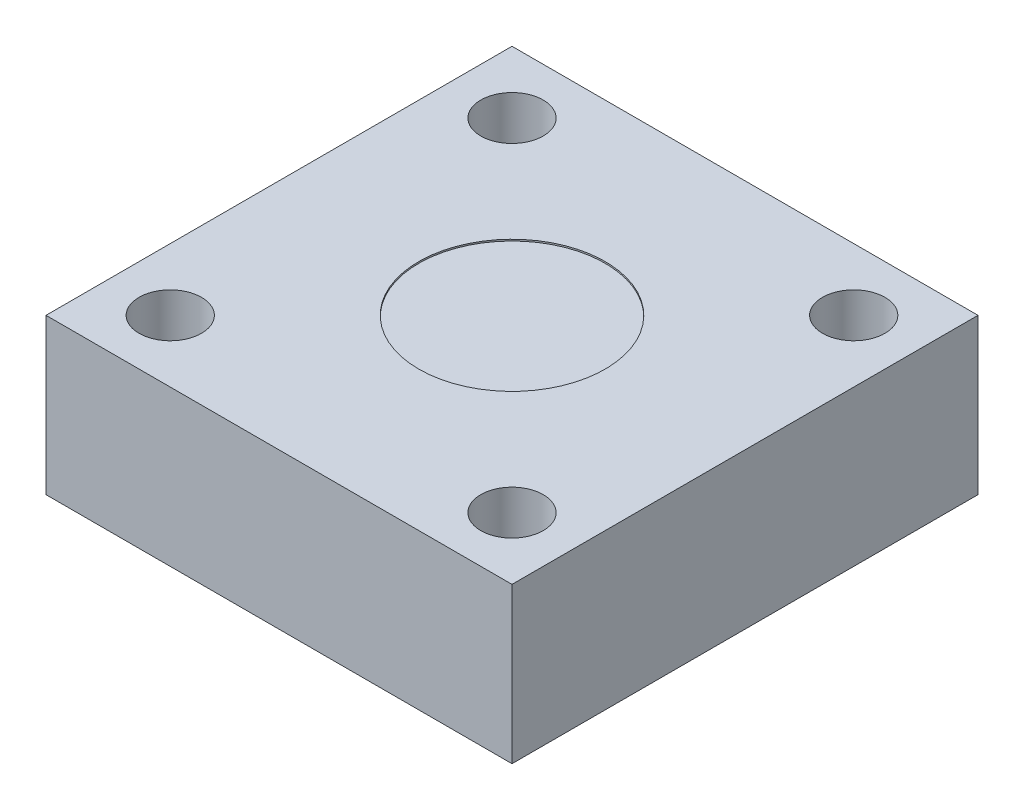
from build123d import *

# Parameters (mm, degrees)
SKETCH1_W                       = 38.1
SKETCH1_H                       = 38.1
BOSS_EXTRUDE1_DEPTH             = 12.7
SKETCH2_R                       = 7.62
CUT_EXTRUDE1_DEPTH              = 0.127
TAP_DRILL_FOR_1_4_20_TAP2_D     = 5.1054
TAP_DRILL_FOR_1_4_20_TAP2_DEPTH = 6.35
TAP_DRILL_FOR_1_4_20_TAP2_TIP   = 1.533816902


with BuildPart() as part:
    # Sketch1 → Boss-Extrude1 (new body)
    with BuildSketch(Plane(origin=(0, 0, 0), x_dir=(1, 0, 0), z_dir=(0, 1, 0))):
        Rectangle(SKETCH1_W, SKETCH1_H)
    extrude(amount=BOSS_EXTRUDE1_DEPTH)

    # Sketch2 → Cut-Extrude1 (cut)
    with BuildSketch(Plane(origin=(0, 12.7, 0), x_dir=(1, 0, 0), z_dir=(0, 1, 0))):
        with Locations(Location((0, 0, 0), (0, 0, 270))):
            Circle(SKETCH2_R)
    extrude(amount=-CUT_EXTRUDE1_DEPTH, mode=Mode.SUBTRACT)

    # Tap Drill for 1/4-20 Tap2
    with Locations(Plane(origin=(0, 12.7, 0), x_dir=(1, 0, 0), z_dir=(0, 1, 0))):
        with Locations((-13.97, 13.97), (13.97, 13.97), (13.97, -13.97), (-13.97, -13.97)):
            Hole(TAP_DRILL_FOR_1_4_20_TAP2_D / 2, depth=TAP_DRILL_FOR_1_4_20_TAP2_DEPTH)
            with Locations((0, 0, -(TAP_DRILL_FOR_1_4_20_TAP2_DEPTH + TAP_DRILL_FOR_1_4_20_TAP2_TIP / 2))):  # 118° drill point
                Cone(0, TAP_DRILL_FOR_1_4_20_TAP2_D / 2, TAP_DRILL_FOR_1_4_20_TAP2_TIP, mode=Mode.SUBTRACT)


solid = part.part
